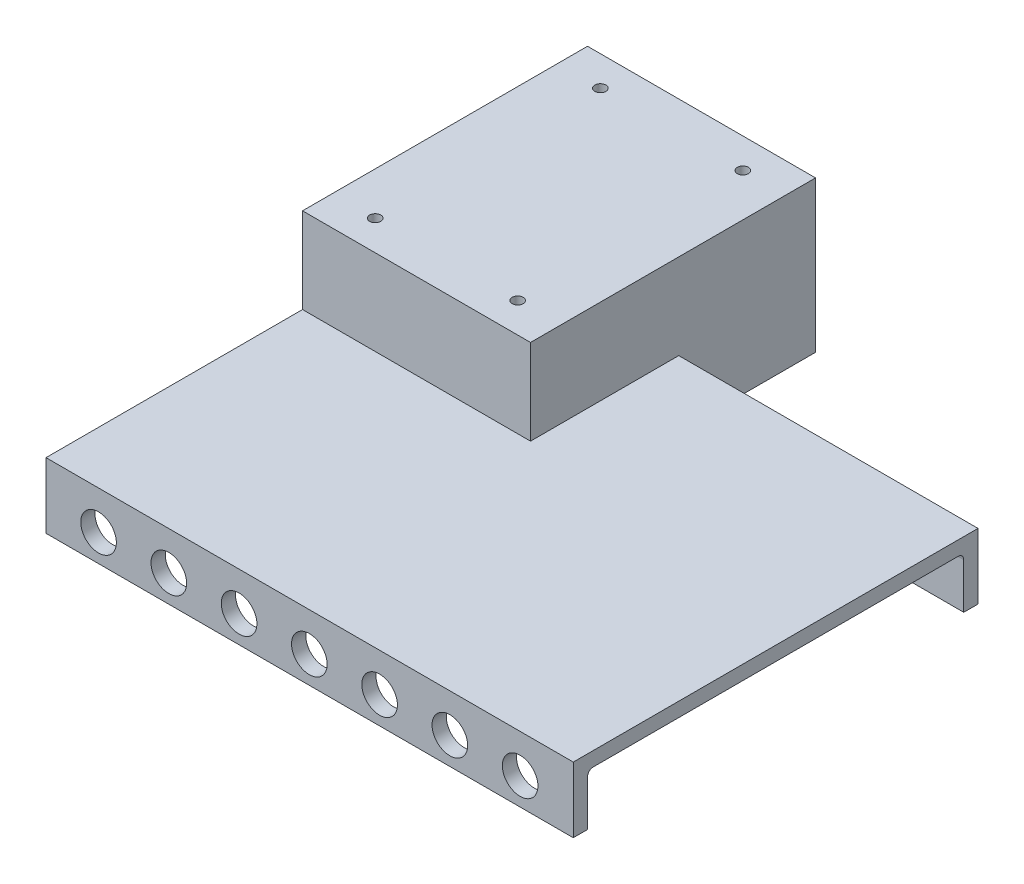
from build123d import *

# Parameters (mm, degrees)
SKETCH1_W           = 185
SKETCH1_H           = 142
BOSS_EXTRUDE1_DEPTH = 23
SKETCH12_W          = 80
SKETCH12_H          = 100
BOSS_EXTRUDE6_DEPTH = 53
SHELL1_T            = -5
SKETCH11_R          = 6.25
CUT_EXTRUDE2_DEPTH  = 6
FILLET1_R           = 2
SKETCH13_R          = 1.95
CUT_EXTRUDE3_DEPTH  = 271.432986154


with BuildPart() as part:
    # Sketch1 → Boss-Extrude1 (new body)
    with BuildSketch(Plane(origin=(0, 0, 0), x_dir=(1, 0, 0), z_dir=(0, 1, 0))):
        with Locations((92.5, 71)):
            Rectangle(SKETCH1_W, SKETCH1_H)
    extrude(amount=BOSS_EXTRUDE1_DEPTH)

    # Sketch12 → Boss-Extrude6 (add)
    with BuildSketch(Plane(origin=(0, 0, 0), x_dir=(1, 0, 0), z_dir=(0, 1, 0))):
        with Locations((40, 140)):
            Rectangle(SKETCH12_W, SKETCH12_H)
    extrude(amount=BOSS_EXTRUDE6_DEPTH)

    # Shell1
    shell1_openings = [part.faces().sort_by_distance(p)[0] for p in [
        (85.804549983, 0, -83.115576221),
        (185, 11.5, -71),
        (0, 22.28697422, -113.317503392),
    ]]
    offset(amount=SHELL1_T, openings=shell1_openings, kind=Kind.INTERSECTION)

    # Sketch11 → Cut-Extrude2 (cut)
    with BuildSketch(Plane.XY):
        with Locations((18.4375, 9.5)):
            Circle(SKETCH11_R)
        with Locations((43.088852194, 9.5)):
            Circle(SKETCH11_R)
        with Locations((67.740204388, 9.5)):
            Circle(SKETCH11_R)
        with Locations((92.391556582, 9.5)):
            Circle(SKETCH11_R)
        with Locations((117.042908776, 9.5)):
            Circle(SKETCH11_R)
        with Locations((141.69426097, 9.5)):
            Circle(SKETCH11_R)
        with Locations((166.345613164, 9.5)):
            Circle(SKETCH11_R)
    extrude(amount=-CUT_EXTRUDE2_DEPTH, mode=Mode.SUBTRACT)

    # Fillet1
    fillet1_edges = [part.edges().sort_by_distance(p)[0] for p in [
        (92.5, 18, -5),
        (130, 18, -137),
        (37.5, 48, -95),
        (75, 48, -140),
        (37.5, 48, -185),
    ]]
    fillet(fillet1_edges, radius=FILLET1_R)

    # Sketch13 → Cut-Extrude3 (cut, through all)
    with BuildSketch(Plane(origin=(0, 53, 0), x_dir=(1, 0, 0), z_dir=(0, 1, 0))):
        with Locations(Location((15, 100.5, 0), (0, 0, 270))):
            Circle(SKETCH13_R)
        with Locations(Location((15, 179.5, 0), (0, 0, 270))):
            Circle(SKETCH13_R)
        with Locations(Location((65, 179.5, 0), (0, 0, 270))):
            Circle(SKETCH13_R)
        with Locations(Location((65, 100.5, 0), (0, 0, 270))):
            Circle(SKETCH13_R)
    extrude(amount=-CUT_EXTRUDE3_DEPTH, mode=Mode.SUBTRACT)


solid = part.part
